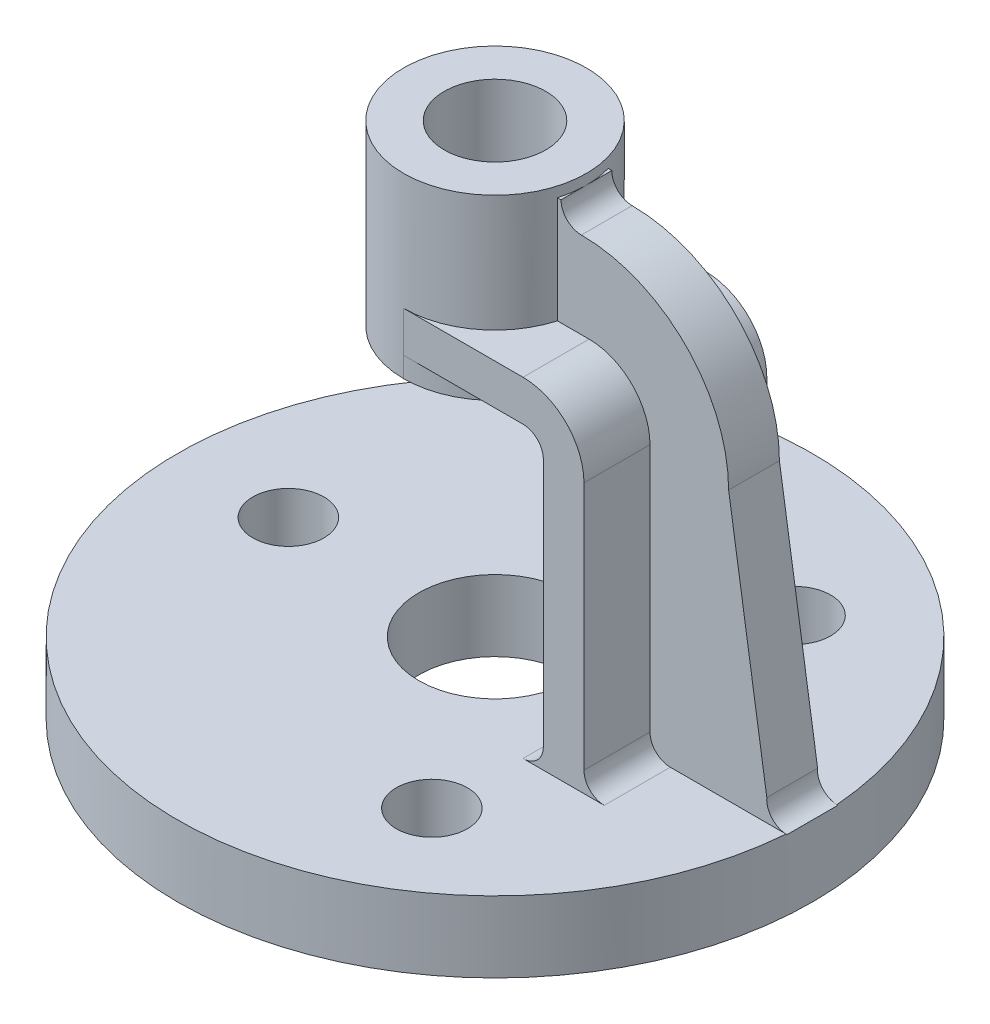
from build123d import *

# Parameters (mm, degrees)
CROQUIS1_R              = 62.5
CROQUIS1_R_2            = 15
SALIENTE_EXTRUIR1_DEPTH = 14
CROQUIS4_R              = 18
CROQUIS4_R_2            = 10
SALIENTE_EXTRUIR3_DEPTH = 35
SALIENTE_EXTRUIR4_DEPTH = 5
SALIENTE_EXTRUIR5_DEPTH = 18
CORTAR_EXTRUIR2_REACH   = 136.969
TALADRO1_D              = 14


with BuildPart() as part:
    # Croquis1 → Saliente-Extruir1 (new body)
    with BuildSketch(Plane(origin=(0, 0, 0), x_dir=(1, 0, 0), z_dir=(0, 1, 0))):
        with Locations(Location((0, 0, 0), (0, 0, 270))):
            Circle(CROQUIS1_R)
        with Locations(Location((0, 0, 0), (0, 0, 270))):
            Circle(CROQUIS1_R_2, mode=Mode.SUBTRACT)
    extrude(amount=SALIENTE_EXTRUIR1_DEPTH)

    # Croquis5 → Saliente-Extruir4 (add, symmetric)
    with BuildSketch(Plane.XY):
        with BuildLine():
            Line((51, 67), (58.515457338, 18.351311508))
            ThreePointArc((58.515457338, 18.351311508), (59.54997915, 15.298634237), (62.5, 14))
            Line((62.5, 14), (23.515457338, 14))
            ThreePointArc((23.515457338, 14), (26.343884463, 15.171572875), (27.515457338, 18))
            Line((27.515457338, 18), (27.515457338, 67))
            ThreePointArc((27.515457338, 67), (26.343884463, 69.828427125), (23.515457338, 71))
            Line((23.515457338, 71), (22, 71))
            ThreePointArc((22, 71), (19.171572875, 69.828427125), (18, 67))
            Line((18, 67), (15.091015764, 67))
            Line((15.091015764, 67), (15.091015764, 100))
            Line((15.091015764, 100), (18, 100))
            ThreePointArc((18, 100), (19.171572875, 97.171572875), (22, 96))
            ThreePointArc((22, 96), (42.506096654, 87.506096654), (51, 67))
        make_face()
    extrude(amount=SALIENTE_EXTRUIR4_DEPTH, both=True)



with BuildPart() as body_2:
    # Croquis4 → Saliente-Extruir3 (new body)
    with BuildSketch(Plane(origin=(0, 67, 0), x_dir=(1, 0, 0), z_dir=(0, 1, 0))):
        with Locations(Location((0, 0, 0), (0, 0, 270))):
            Circle(CROQUIS4_R)
        with Locations(Location((0, 0, 0), (0, 0, 270))):
            Circle(CROQUIS4_R_2, mode=Mode.SUBTRACT)
    extrude(amount=SALIENTE_EXTRUIR3_DEPTH)


with BuildPart() as part_1:
    add(part.part)

    add(body_2.part)  # Saliente-Extruir5 merges body 2
    # Croquis6 → Saliente-Extruir5 (add, symmetric)
    with BuildSketch(Plane.XY):
        with BuildLine():
            Line((23.515457338, 71), (0, 71))
            Line((0, 71), (0, 79))
            Line((0, 79), (23.515457338, 79))
            ThreePointArc((23.515457338, 79), (32.000738712, 75.485281374), (35.515457338, 67))
            Line((35.515457338, 67), (35.515457338, 18))
            ThreePointArc((35.515457338, 18), (36.687030213, 15.171572875), (39.515457338, 14))
            Line((39.515457338, 14), (23.515457338, 14))
            ThreePointArc((23.515457338, 14), (26.343884463, 15.171572875), (27.515457338, 18))
            Line((27.515457338, 18), (27.515457338, 67))
            ThreePointArc((27.515457338, 67), (26.343884463, 69.828427125), (23.515457338, 71))
        make_face()
    extrude(amount=SALIENTE_EXTRUIR5_DEPTH, both=True)

    # Croquis8 → Cortar-Extruir2 (cut, up to next)
    with BuildSketch(Plane(origin=(0, 0, 0), x_dir=(1, 0, 0), z_dir=(0, 1, 0)), mode=Mode.PRIVATE) as cortar_extruir2_sk1:
        with BuildLine():
            Line((0, 10), (0, -10))
            ThreePointArc((0, -10), (10, 0), (0, 10))
        make_face()
    cortar_extruir2_tool1 = extrude(cortar_extruir2_sk1.sketch, amount=CORTAR_EXTRUIR2_REACH, mode=Mode.PRIVATE) & part_1.part
    add(cortar_extruir2_tool1.solids().sort_by_distance((4.244132, 0, 0))[0], mode=Mode.SUBTRACT)

    # Taladro1 (through all)
    with Locations(Plane(origin=(-40.684234859, 14, 0), x_dir=(0, 0, 1), z_dir=(0, 1, 0))):
        with Locations((0, 0), (-33.165738319, 66.596434384), (35.465774798, 63.717449074)):
            Hole(TALADRO1_D / 2)


solid = part_1.part
